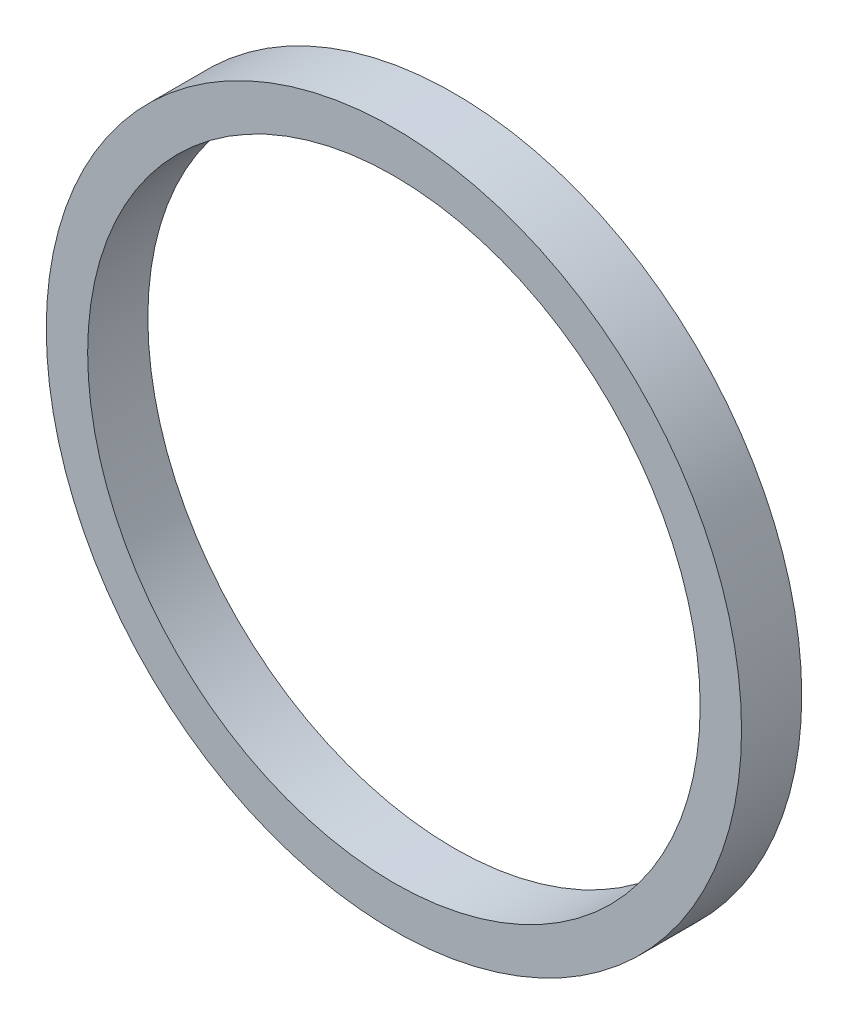
from build123d import *

# Parameters (mm, degrees)
SKETCH1_R           = 5.775
SKETCH1_R_2         = 5.0875
BOSS_EXTRUDE1_DEPTH = 1


with BuildPart() as part:
    # Sketch1 → Boss-Extrude1 (new body)
    with BuildSketch(Plane.XY):
        Circle(SKETCH1_R)
        Circle(SKETCH1_R_2, mode=Mode.SUBTRACT)
    extrude(amount=BOSS_EXTRUDE1_DEPTH)


solid = part.part
